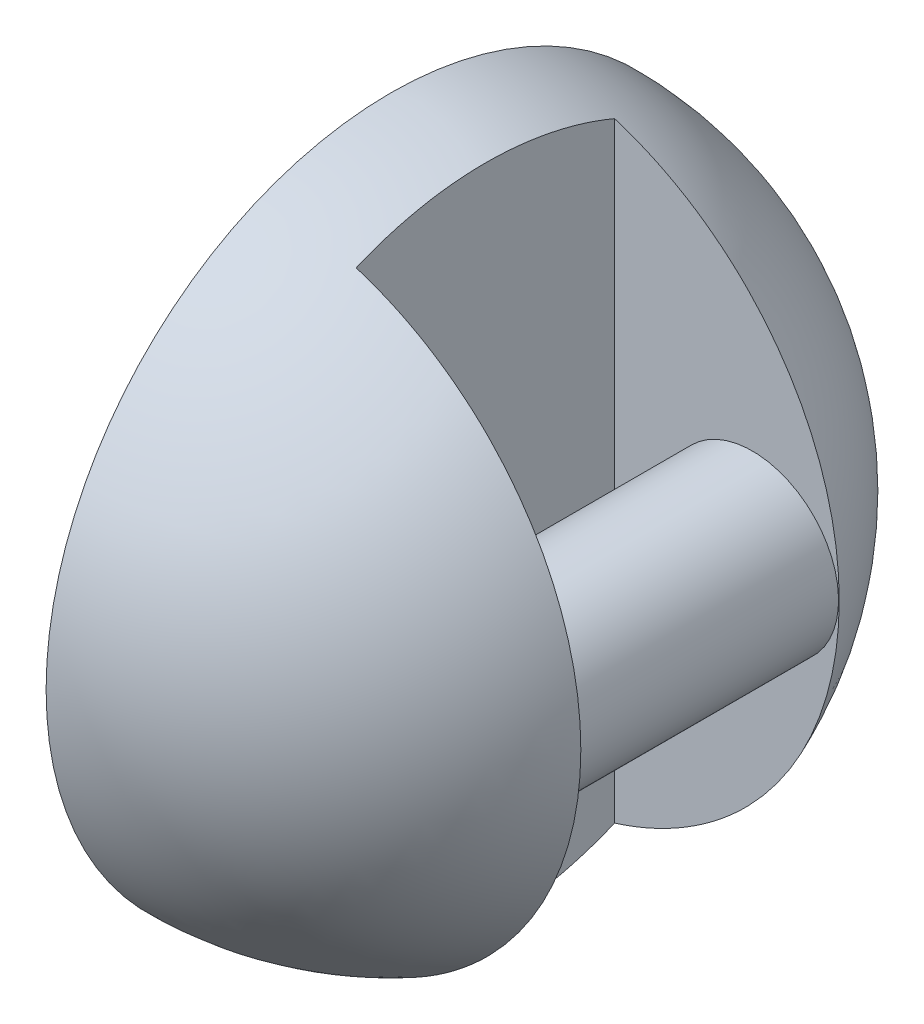
from build123d import *
from build123d.topology import SkipClean

# Parameters (mm, degrees)
SKETCH2_R           = 20
CUT_EXTRUDE1_DEPTH  = 30
SKETCH9_W           = 15
SKETCH9_H           = 41
CUT_EXTRUDE4_DEPTH  = 14.5
SKETCH10_R          = 5
BOSS_EXTRUDE2_DEPTH = 15
SKETCH11_R          = 5
CUT_EXTRUDE5_DEPTH  = 5


with BuildPart() as part:
    # Sketch3 → Revolve1 (revolve)
    with BuildSketch(Plane.XY):
        with BuildLine():
            Line((0, 20), (0, -20))
            ThreePointArc((0, -20), (20, 0), (0, 20))
        make_face()
    revolve(axis=Axis((0, 20, 0), (0, -1, 0)))

    # Sketch2 → Cut-Extrude1 (cut)
    with SkipClean():  # the faces are left unmerged after this step: merging them gives an invalid solid
        with BuildSketch(Plane(origin=(0, 0, 0), x_dir=(0, 0, -1), z_dir=(1, 0, 0))):
            Circle(SKETCH2_R)
        extrude(amount=-CUT_EXTRUDE1_DEPTH, mode=Mode.SUBTRACT)

    # Sketch9 → Cut-Extrude4 (cut)
    with SkipClean():  # the faces are left unmerged after this step: merging them gives an invalid solid
        with BuildSketch(Plane(origin=(20, 0, 0), x_dir=(0, 0, -1), z_dir=(1, 0, 0))):
            Rectangle(SKETCH9_W, SKETCH9_H)
        extrude(amount=-CUT_EXTRUDE4_DEPTH, mode=Mode.SUBTRACT)

    # Sketch10 → Boss-Extrude2 (add)
    with SkipClean():  # the faces are left unmerged after this step: merging them gives an invalid solid
        with BuildSketch(Plane(origin=(0, 0, 7.5), x_dir=(-1, 0, 0), z_dir=(0, 0, -1))):
            with Locations(Location((-13.5, 0, 0), (0, 0, 270))):
                Circle(SKETCH10_R)
        extrude(amount=BOSS_EXTRUDE2_DEPTH)

    # Sketch11 → Cut-Extrude5 (cut)
    with SkipClean():  # the faces are left unmerged after this step: merging them gives an invalid solid
        with BuildSketch(Plane.ZY):
            Circle(SKETCH11_R)
        extrude(amount=-CUT_EXTRUDE5_DEPTH, mode=Mode.SUBTRACT)


solid = part.part
